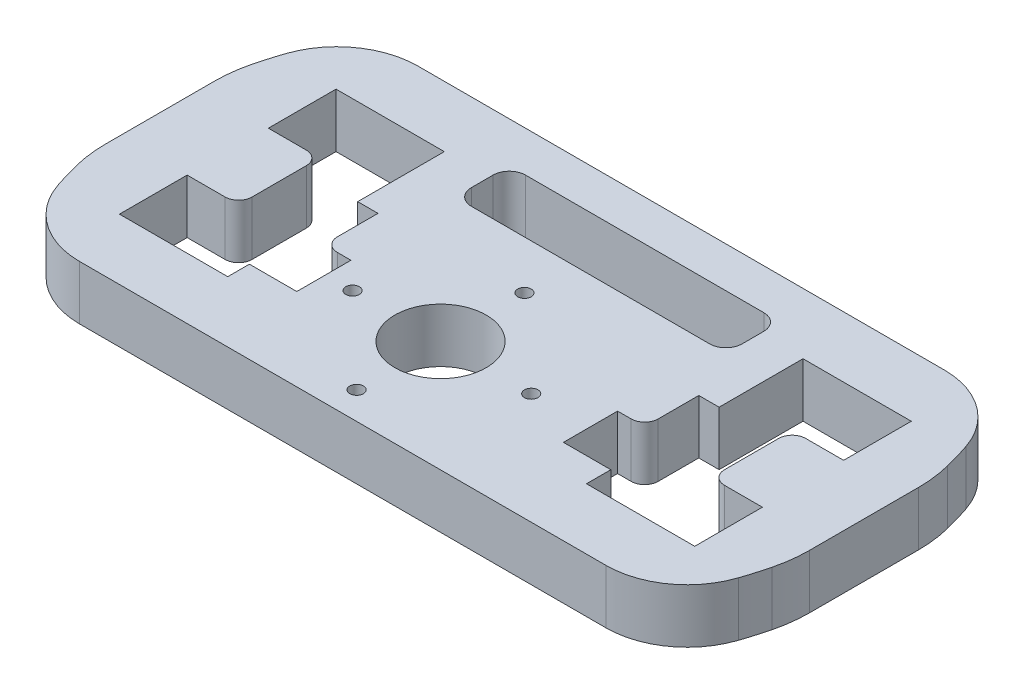
from build123d import *

# Parameters (mm, degrees)
SCHIZZO1_R                   = 3.375
ESTRUSIONE_ESTRUSIONE1_DEPTH = 4
RACCORDO1_R                  = 6
RACCORDO4_R                  = 6
RACCORDO5_R                  = 6
RACCORDO6_R                  = 6
RACCORDO8_R                  = 10
RACCORDO9_R                  = 10
RACCORDO10_R                 = 10
RACCORDO11_R                 = 10
SCHIZZO2_R                   = 0.5
TAGLIO_ESTRUSIONE1_DEPTH     = 58.835974964


with BuildPart() as part:
    # Schizzo1 → Estrusione-Estrusione1 (new body)
    with BuildSketch(Plane(origin=(0, 0, 0), x_dir=(1, 0, 0), z_dir=(0, 1, 0))):
        with BuildLine():
            ThreePointArc((0, 7.376524617), (1.042643641, 3.590434154), (2.633357109, 0))
            Line((2.633357109, 0), (49.366642891, 0))
            ThreePointArc((49.366642891, 0), (50.957356359, 3.590434154), (52, 7.376524617))
            Line((52, 7.376524617), (52, 17.623475383))
            ThreePointArc((52, 17.623475383), (50.957356359, 21.409565846), (49.366642891, 25))
            Line((49.366642891, 25), (2.633357109, 25))
            ThreePointArc((2.633357109, 25), (1.042643641, 21.409565846), (0, 17.623475383))
            Line((0, 17.623475383), (0, 7.376524617))
        make_face()
        with BuildLine():
            Line((17.5, 22), (35.1, 22))
            ThreePointArc((35.1, 22), (35.948528137, 21.648528137), (36.3, 20.8))
            Line((36.3, 20.8), (36.3, 19.2))
            ThreePointArc((36.3, 19.2), (35.948528137, 18.351471863), (35.1, 18))
            Line((35.1, 18), (17.5, 18))
            ThreePointArc((17.5, 18), (16.651471863, 18.351471863), (16.3, 19.2))
            Line((16.3, 19.2), (16.3, 20.8))
            ThreePointArc((16.3, 20.8), (16.651471863, 21.648528137), (17.5, 22))
        make_face(mode=Mode.SUBTRACT)
        with Locations(Location((25, 8.22, 0), (0, 0, 270))):
            Circle(SCHIZZO1_R, mode=Mode.SUBTRACT)
        with BuildLine():
            Line((5, 15.5), (5, 20.5))
            Line((5, 20.5), (13, 20.5))
            Line((13, 20.5), (13, 14.1))
            Line((13, 14.1), (14.5, 14.1))
            Line((14.5, 14.1), (14.5, 11.1))
            ThreePointArc((14.5, 11.1), (14.792893219, 10.392893219), (15.5, 10.1))
            Line((15.5, 10.1), (16.5, 10.1))
            Line((16.5, 10.1), (16.5, 6.1))
            Line((16.5, 6.1), (13, 6.1))
            Line((13, 6.1), (13, 4.5))
            Line((13, 4.5), (5, 4.5))
            Line((5, 4.5), (5, 9.5))
            Line((5, 9.5), (7.8, 9.5))
            ThreePointArc((7.8, 9.5), (8.507106781, 9.792893219), (8.8, 10.5))
            Line((8.8, 10.5), (8.8, 14.5))
            ThreePointArc((8.8, 14.5), (8.507106781, 15.207106781), (7.8, 15.5))
            Line((7.8, 15.5), (5, 15.5))
        make_face(mode=Mode.SUBTRACT)
        with BuildLine():
            Line((36, 10.3), (37, 10.3))
            ThreePointArc((37, 10.3), (37.707106781, 10.592893219), (38, 11.3))
            Line((38, 11.3), (38, 14.3))
            Line((38, 14.3), (39.5, 14.3))
            Line((39.5, 14.3), (39.5, 20.5))
            Line((39.5, 20.5), (47.5, 20.5))
            Line((47.5, 20.5), (47.5, 15.5))
            Line((47.5, 15.5), (44.7, 15.5))
            ThreePointArc((44.7, 15.5), (43.992893219, 15.207106781), (43.7, 14.5))
            Line((43.7, 14.5), (43.7, 10.5))
            ThreePointArc((43.7, 10.5), (43.992893219, 9.792893219), (44.7, 9.5))
            Line((44.7, 9.5), (47.5, 9.5))
            Line((47.5, 9.5), (47.5, 4.5))
            Line((47.5, 4.5), (39.5, 4.5))
            Line((39.5, 4.5), (39.5, 6.3))
            Line((39.5, 6.3), (36, 6.3))
            Line((36, 6.3), (36, 10.3))
        make_face(mode=Mode.SUBTRACT)
    extrude(amount=ESTRUSIONE_ESTRUSIONE1_DEPTH)

    # Raccordo1
    raccordo1_edges = [part.edges().sort_by_distance(p)[0] for p in [
        (2.633357109, 2, -25),
    ]]
    fillet(raccordo1_edges, radius=RACCORDO1_R)

    # Raccordo4
    raccordo4_edges = [part.edges().sort_by_distance(p)[0] for p in [
        (2.633357109, 2, 0),
    ]]
    fillet(raccordo4_edges, radius=RACCORDO4_R)

    # Raccordo5
    raccordo5_edges = [part.edges().sort_by_distance(p)[0] for p in [
        (49.366642891, 2, -25),
    ]]
    fillet(raccordo5_edges, radius=RACCORDO5_R)

    # Raccordo6
    raccordo6_edges = [part.edges().sort_by_distance(p)[0] for p in [
        (49.366642891, 2, 0),
    ]]
    fillet(raccordo6_edges, radius=RACCORDO6_R)

    # Raccordo8
    raccordo8_edges = [part.edges().sort_by_distance(p)[0] for p in [
        (0, 2, -7.376524617),
    ]]
    fillet(raccordo8_edges, radius=RACCORDO8_R)

    # Raccordo9
    raccordo9_edges = [part.edges().sort_by_distance(p)[0] for p in [
        (0, 2, -17.623475383),
    ]]
    fillet(raccordo9_edges, radius=RACCORDO9_R)

    # Raccordo10
    raccordo10_edges = [part.edges().sort_by_distance(p)[0] for p in [
        (52, 2, -17.623475383),
    ]]
    fillet(raccordo10_edges, radius=RACCORDO10_R)

    # Raccordo11
    raccordo11_edges = [part.edges().sort_by_distance(p)[0] for p in [
        (52, 2, -7.376524617),
    ]]
    fillet(raccordo11_edges, radius=RACCORDO11_R)

    # Schizzo2 → Taglio-Estrusione1 (cut, through all)
    with BuildSketch(Plane.XZ):
        with Locations(Location((25, -14.42, 0), (0, 0, 270))):
            Circle(SCHIZZO2_R)
        with Locations(Location((31.7, -8.22, 0), (0, 0, 270))):
            Circle(SCHIZZO2_R)
        with Locations(Location((18.5, -8.22, 0), (0, 0, 270))):
            Circle(SCHIZZO2_R)
        with Locations(Location((25, -2.02, 0), (0, 0, 270))):
            Circle(SCHIZZO2_R)
    extrude(amount=-TAGLIO_ESTRUSIONE1_DEPTH, mode=Mode.SUBTRACT)


solid = part.part
